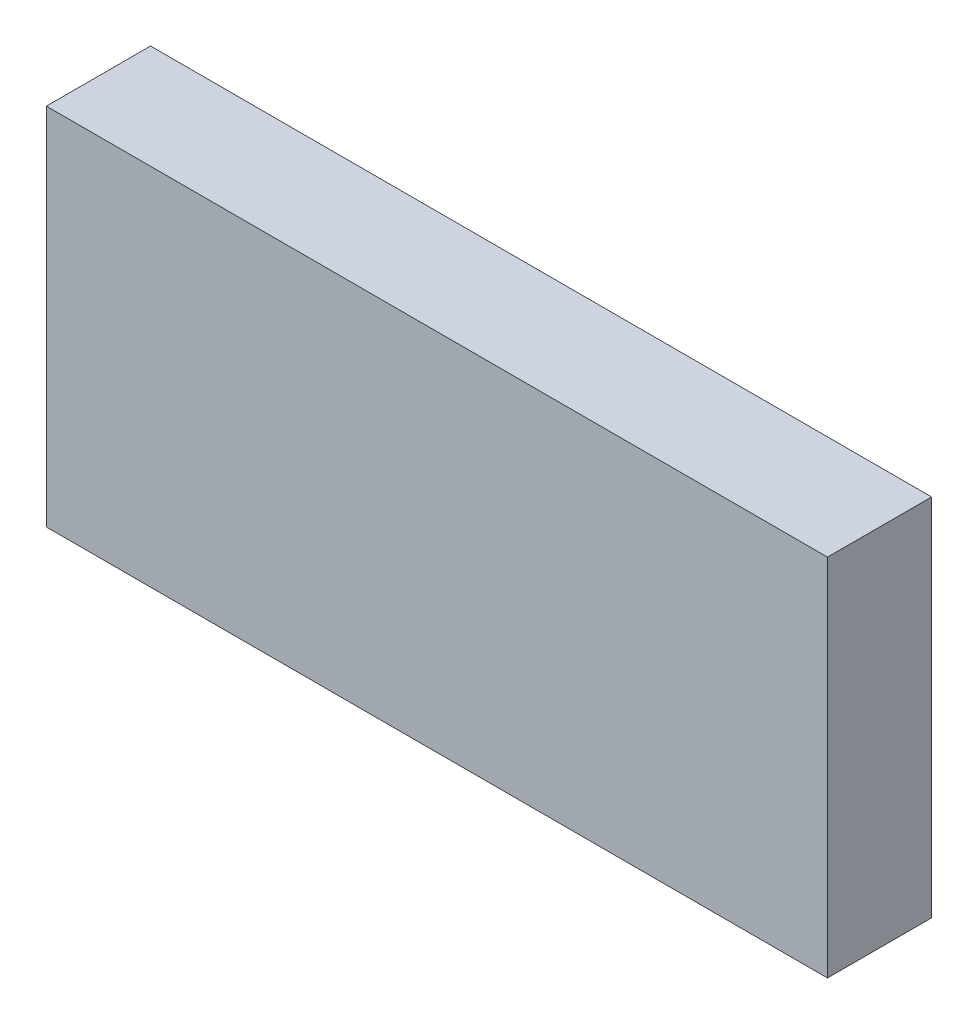
from build123d import *

# Parameters (mm, degrees)
SKETCH_1_W      = 150
SKETCH_1_H      = 70
EXTRUDE_1_DEPTH = 20


with BuildPart() as part:
    # 草图1 → 凸台-拉伸1 (new body)
    with BuildSketch(Plane.XY):
        Rectangle(SKETCH_1_W, SKETCH_1_H)
    extrude(amount=EXTRUDE_1_DEPTH)


solid = part.part
